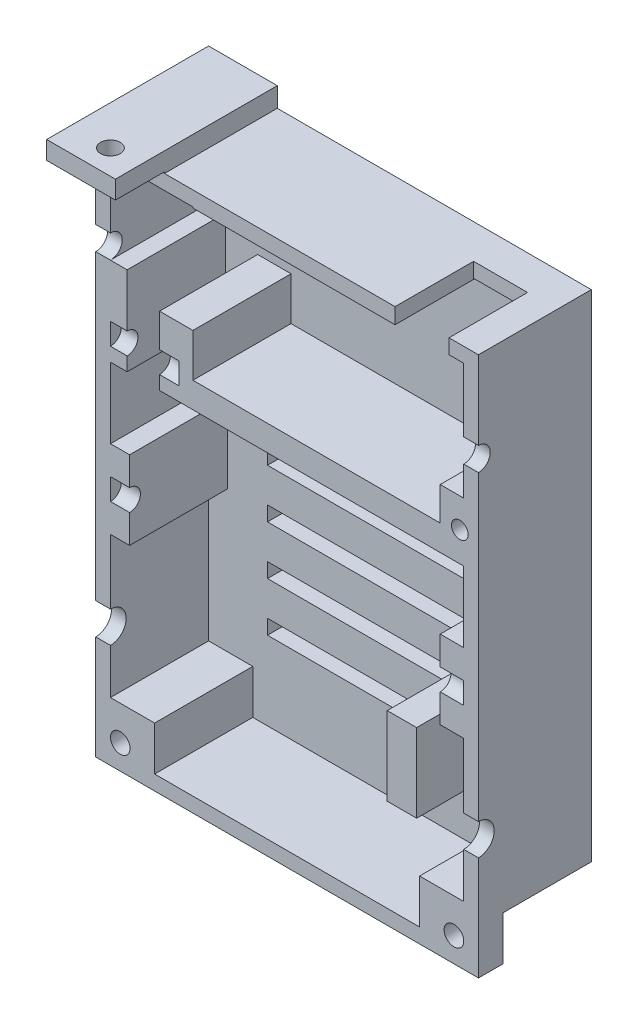
from build123d import *

# Parameters (mm, degrees)
SKETCH_1_W           = 39
SKETCH_1_H           = 55
EXTRUDE_1_DEPTH      = 11.5
SHELL_1_T            = -1.5
SKETCH_2_W           = 7
SKETCH_2_H           = 2
EXTRUDE_2_DEPTH      = 16.5
SKETCH_3_R           = 1
CUT_EXTRUDE_1_DEPTH  = 2
SKETCH_4_W           = 5.5
SKETCH_4_H           = 8
CUT_EXTRUDE_2_DEPTH  = 1.5
SKETCH_5_R           = 1.2
SKETCH_5_R_2         = 1.6
CUT_EXTRUDE_3_DEPTH  = 52.609107723
SKETCH_8_W           = 1.95
SKETCH_8_H           = 8
SKETCH_8_W_2         = 2.4
SKETCH_8_W_3         = 1.7
SKETCH_8_H_2         = 9
SKETCH_8_W_4         = 4.5
SKETCH_8_H_3         = 4.5
SKETCH_8_W_5         = 20.6
SKETCH_8_H_4         = 0.1
EXTRUDE_3_DEPTH      = 11.5
CUT_EXTRUDE_START    = -1.5
SKETCH_10_R          = 1.1
CUT_EXTRUDE_12_DEPTH = 7
SKETCH_7_R           = 1.1
CUT_EXTRUDE_13_DEPTH = 36
SKETCH_13_W          = 24
SKETCH_13_H          = 1.5
CUT_EXTRUDE_14_DEPTH = 1.5
SKETCH_12_W          = 3
SKETCH_12_H          = 8
EXTRUDE_4_DEPTH      = 8.5
SKETCH_14_W          = 7
SKETCH_14_H          = 0.15
CUT_EXTRUDE_15_DEPTH = 5
SKETCH_15_W          = 4.5
SKETCH_15_H          = 4.5
CUT_EXTRUDE_16_DEPTH = 9
SKETCH_16_R          = 1
CUT_EXTRUDE_17_DEPTH = 2.5
CUT_EXTRUDE_START_2  = -11.5
SKETCH_17_R          = 0.85
CUT_EXTRUDE_18_DEPTH = 2.5


with BuildPart() as part:
    # 草图1 → 凸台-拉伸1 (new body)
    with BuildSketch(Plane.XY):
        Rectangle(SKETCH_1_W, SKETCH_1_H)
    extrude(amount=EXTRUDE_1_DEPTH)

    # 抽壳1
    shell_1_openings = [part.faces().sort_by_distance(p)[0] for p in [
        (0, 0, 11.5),
    ]]
    offset(amount=SHELL_1_T, openings=shell_1_openings, kind=Kind.INTERSECTION)

    # 草图4 → 切除-拉伸2 (cut)
    with BuildSketch(Plane(origin=(0, 27.5, 0), x_dir=(1, 0, 0), z_dir=(0, 1, 0))):
        with Locations((13.75, -7.5)):
            Rectangle(SKETCH_4_W, SKETCH_4_H)
    extrude(amount=-CUT_EXTRUDE_2_DEPTH, mode=Mode.SUBTRACT)

    # 草图5 → 切除-拉伸3 (cut, through all)
    with BuildSketch(Plane.ZY.offset(19.5)):
        with Locations((11.5, 18.3)):
            Circle(SKETCH_5_R)
        with Locations((11.5, -15.3)):
            Circle(SKETCH_5_R_2)
    extrude(amount=-CUT_EXTRUDE_3_DEPTH, mode=Mode.SUBTRACT)

    # 草图8 → 凸台-拉伸3 (add)
    with BuildSketch(Plane(origin=(0, 0, 0), x_dir=(-1, 0, 0), z_dir=(0, 0, -1))):
        with Locations((17.025, -3.1)):
            Rectangle(SKETCH_8_W, SKETCH_8_H)
        with Locations((-16.8, -3.1)):
            Rectangle(SKETCH_8_W_2, SKETCH_8_H)
        Polygon((-15.6, 14.1), (-18, 14.1), (-18, 8.1), (13, 8.1), (13, 15.1), (9.6, 15.1), (9.6, 10.7), (-15.6, 10.7), align=None)
        with Locations((17.15, 12.6)):
            Rectangle(SKETCH_8_W_3, SKETCH_8_H_2)
        with Locations((15.75, -23.75)):
            Rectangle(SKETCH_8_W_4, SKETCH_8_H_3)
        with Locations((-15.75, -23.75)):
            Rectangle(SKETCH_8_W_4, SKETCH_8_H_3)
        with Locations((-0.7, 25.95)):
            Rectangle(SKETCH_8_W_5, SKETCH_8_H_4)
    extrude(amount=-EXTRUDE_3_DEPTH)

    # 草图10 → 切除-拉伸12 (cut)
    with BuildSketch(Plane.ZY.offset(19.5).offset(CUT_EXTRUDE_START)):
        with Locations((11.5, 10.6)):
            Circle(SKETCH_10_R)
    extrude(amount=-CUT_EXTRUDE_12_DEPTH, mode=Mode.SUBTRACT)

    # 草图7 → 切除-拉伸13 (cut)
    with BuildSketch(Plane.ZY.offset(19.5).offset(CUT_EXTRUDE_START)):
        with Locations((11.5, -3.1)):
            Circle(SKETCH_7_R)
    extrude(amount=-CUT_EXTRUDE_13_DEPTH, mode=Mode.SUBTRACT)

    # 草图13 → 切除-拉伸14 (cut)
    with BuildSketch(Plane(origin=(0, 0, 0), x_dir=(-1, 0, 0), z_dir=(0, 0, -1))):
        with Locations((0, -17.25)):
            Rectangle(SKETCH_13_W, SKETCH_13_H)
        with Locations((0, -12.25)):
            Rectangle(SKETCH_13_W, SKETCH_13_H)
        with Locations((0, -7.25)):
            Rectangle(SKETCH_13_W, SKETCH_13_H)
        with Locations((0, -2.25)):
            Rectangle(SKETCH_13_W, SKETCH_13_H)
        with Locations((0, 2.75)):
            Rectangle(SKETCH_13_W, SKETCH_13_H)
        with Locations((0, 7.75)):
            Rectangle(SKETCH_13_W, SKETCH_13_H)
    extrude(amount=-CUT_EXTRUDE_14_DEPTH, mode=Mode.SUBTRACT)

    # 草图12 → 凸台-拉伸4 (add)
    with BuildSketch(Plane(origin=(0, 0, 0), x_dir=(-1, 0, 0), z_dir=(0, 0, -1))):
        with Locations((-8.7, -15.55)):
            Rectangle(SKETCH_12_W, SKETCH_12_H)
    extrude(amount=-EXTRUDE_4_DEPTH)

    # 草图15 → 切除-拉伸16 (cut)
    with BuildSketch(Plane(origin=(0, 0, 0), x_dir=(-1, 0, 0), z_dir=(0, 0, -1))):
        with Locations((17.25, -25.25)):
            Rectangle(SKETCH_15_W, SKETCH_15_H)
        with Locations((-17.25, -25.25)):
            Rectangle(SKETCH_15_W, SKETCH_15_H)
    extrude(amount=-CUT_EXTRUDE_16_DEPTH, mode=Mode.SUBTRACT)

    # 草图16 → 切除-拉伸17 (cut)
    with BuildSketch(Plane(origin=(0, 0, 9), x_dir=(-1, 0, 0), z_dir=(0, 0, -1))):
        with Locations((-17, -25)):
            Circle(SKETCH_16_R)
        with Locations((17, -25)):
            Circle(SKETCH_16_R)
    extrude(amount=-CUT_EXTRUDE_17_DEPTH, mode=Mode.SUBTRACT)

    # 草图17 → 切除-拉伸18 (cut)
    with BuildSketch(Plane(origin=(0, 0, 0), x_dir=(-1, 0, 0), z_dir=(0, 0, -1)).offset(CUT_EXTRUDE_START_2)):
        with Locations((-17.6, 11.1)):
            Circle(SKETCH_17_R)
    extrude(amount=CUT_EXTRUDE_18_DEPTH, mode=Mode.SUBTRACT)


with BuildPart() as body_2:
    # 草图2 → 凸台-拉伸2 (new body)
    with BuildSketch(Plane(origin=(0, 0, 0), x_dir=(-1, 0, 0), z_dir=(0, 0, -1))):
        with Locations((16, 28.5)):
            Rectangle(SKETCH_2_W, SKETCH_2_H)
    extrude(amount=-EXTRUDE_2_DEPTH)

    # 草图3 → 切除-拉伸1 (cut)
    with BuildSketch(Plane(origin=(0, 29.5, 0), x_dir=(1, 0, 0), z_dir=(0, 1, 0))):
        with Locations(Location((-15.501988962, -14, 0), (0, 0, 180))):
            Circle(SKETCH_3_R)
    extrude(amount=-CUT_EXTRUDE_1_DEPTH, mode=Mode.SUBTRACT)

    # 草图14 → 切除-拉伸15 (cut)
    with BuildSketch(Plane.XY.offset(16.5)):
        with Locations((-16, 27.575)):
            Rectangle(SKETCH_14_W, SKETCH_14_H)
    extrude(amount=-CUT_EXTRUDE_15_DEPTH, mode=Mode.SUBTRACT)


solid = Compound([part.part, body_2.part])
